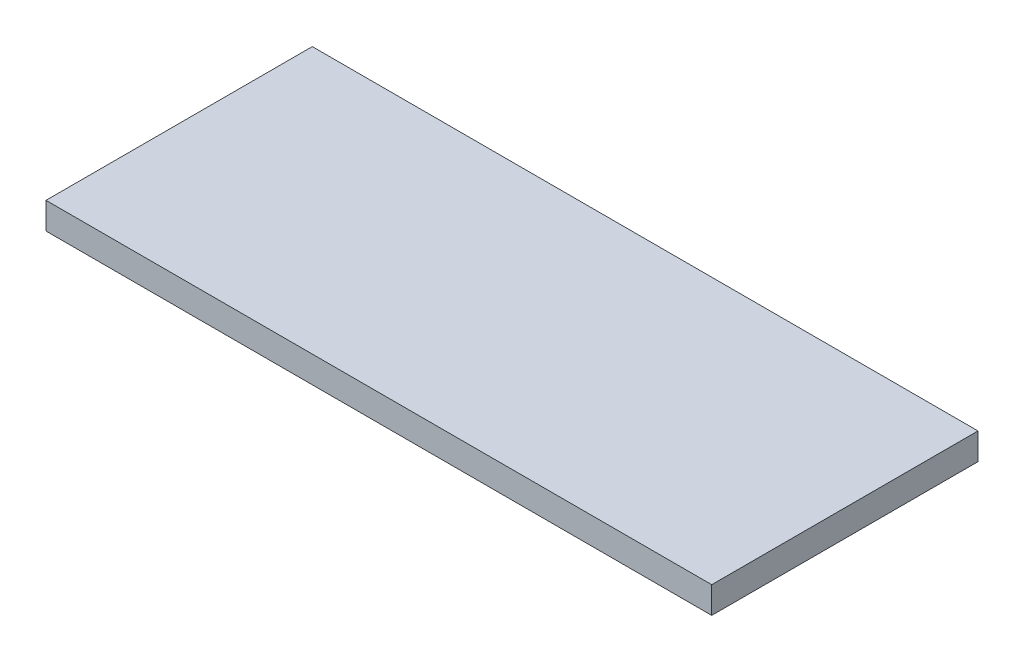
from build123d import *

# Parameters (mm, degrees)
SKETCH1_W           = 5000
SKETCH1_H           = 2000
BOSS_EXTRUDE3_DEPTH = 200


with BuildPart() as part:
    # Sketch1 → Boss-Extrude3 (new body)
    with BuildSketch(Plane(origin=(0, 0, 0), x_dir=(1, 0, 0), z_dir=(0, 1, 0))):
        Rectangle(SKETCH1_W, SKETCH1_H)
    extrude(amount=BOSS_EXTRUDE3_DEPTH)


solid = part.part
